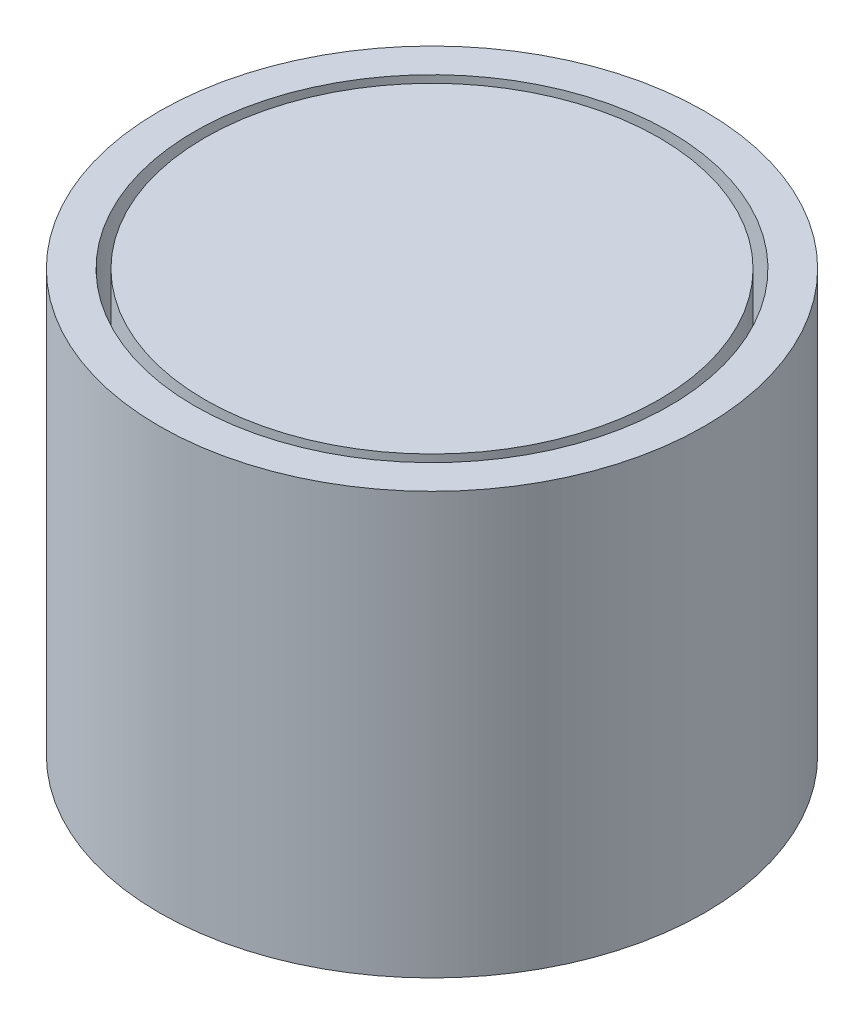
from build123d import *

# Parameters (mm, degrees)
SKETCH_1_R          = 11
EXTRUDE_1_DEPTH     = 17
SKETCH_2_R          = 9.582864225
CUT_EXTRUDE_1_DEPTH = 16
SKETCH_3_R          = 9.157454318
EXTRUDE_2_DEPTH     = 16


with BuildPart() as part:
    # 草图1 → 凸台-拉伸1 (new body)
    with BuildSketch(Plane(origin=(0, 0, 0), x_dir=(1, 0, 0), z_dir=(0, 1, 0))):
        with Locations(Location((0, 0, 0), (0, 0, 270))):
            Circle(SKETCH_1_R)
    extrude(amount=EXTRUDE_1_DEPTH)

    # 草图2 → 切除-拉伸1 (cut)
    with BuildSketch(Plane(origin=(0, 17, 0), x_dir=(1, 0, 0), z_dir=(0, 1, 0))):
        with Locations(Location((0, 0, 0), (0, 0, 270))):
            Circle(SKETCH_2_R)
    extrude(amount=-CUT_EXTRUDE_1_DEPTH, mode=Mode.SUBTRACT)

    # 草图3 → 凸台-拉伸2 (add)
    with BuildSketch(Plane(origin=(0, 1, 0), x_dir=(1, 0, 0), z_dir=(0, 1, 0))):
        with Locations(Location((0, 0, 0), (0, 0, 270))):
            Circle(SKETCH_3_R)
    extrude(amount=EXTRUDE_2_DEPTH)


solid = part.part
